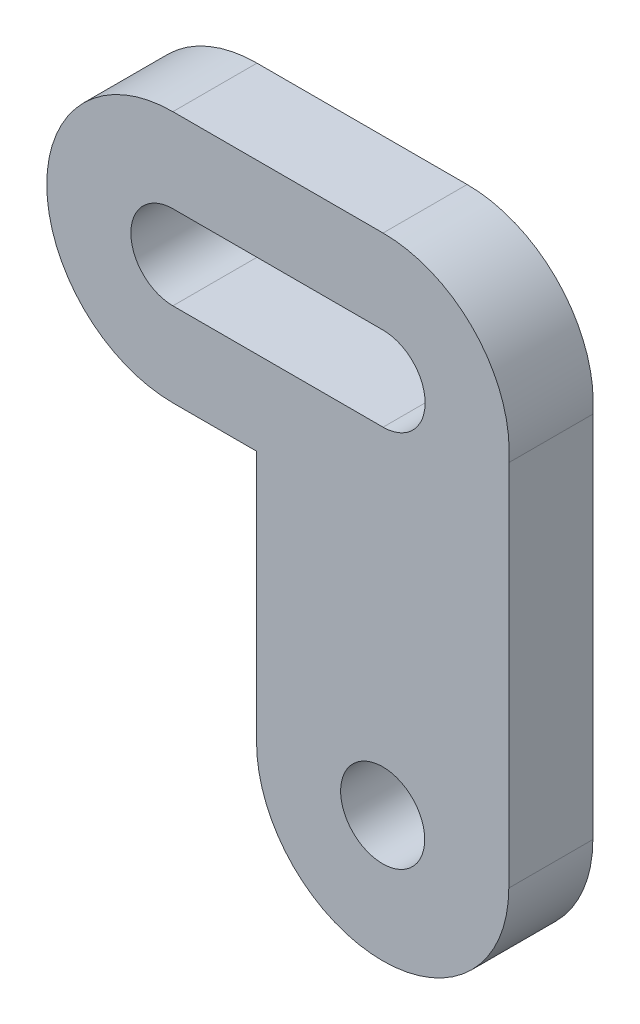
from build123d import *

# Parameters (mm, degrees)
MODEL_R                 = 1.5
SALIENTE_EXTRUIR1_DEPTH = 3


with BuildPart() as part:
    # Model → Saliente-Extruir1 (new body)
    with BuildSketch(Plane.XY):
        with BuildLine():
            Line((160.698926217, 226.370073483), (160.698926217, 239.515886932))
            ThreePointArc((160.698926217, 239.515886932), (159.517719337, 242.924264089), (156.212886551, 244.370073483))
            Line((156.212886551, 244.370073483), (148.712886551, 244.370073483))
            ThreePointArc((148.712886551, 244.370073483), (144.212886551, 239.870073483), (148.712886551, 235.370073483))
            Line((148.712886551, 235.370073483), (151.698926217, 235.370073483))
            Line((151.698926217, 235.370073483), (151.698926217, 226.370073483))
            ThreePointArc((151.698926217, 226.370073483), (156.198926217, 221.870073483), (160.698926217, 226.370073483))
        make_face()
        with Locations((156.198926217, 226.370073483)):
            Circle(MODEL_R, mode=Mode.SUBTRACT)
        with BuildLine():
            ThreePointArc((156.212886551, 241.370073483), (157.712886551, 239.870073483), (156.212886551, 238.370073483))
            Line((156.212886551, 238.370073483), (148.712886551, 238.370073483))
            ThreePointArc((148.712886551, 238.370073483), (147.212886551, 239.870073483), (148.712886551, 241.370073483))
            Line((148.712886551, 241.370073483), (156.212886551, 241.370073483))
        make_face(mode=Mode.SUBTRACT)
    extrude(amount=SALIENTE_EXTRUIR1_DEPTH)


solid = part.part
